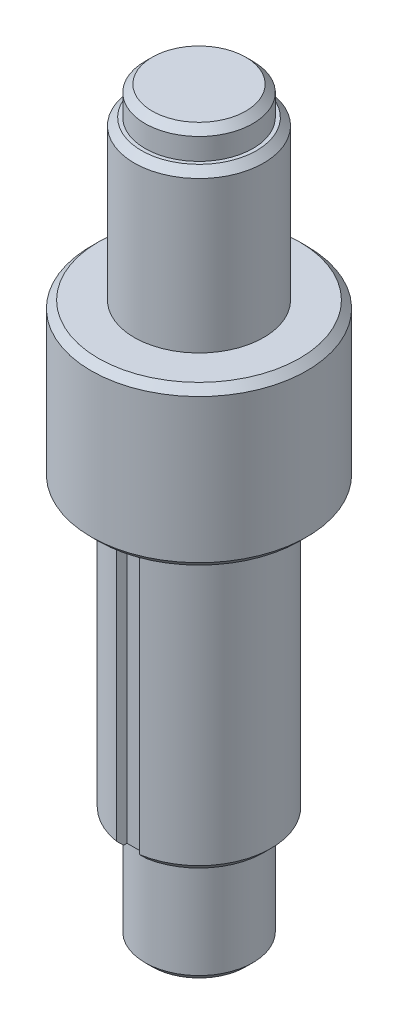
from build123d import *

# Parameters (mm, degrees)
SKETCH2_W          = 3.25
SKETCH2_H          = 3.25
CUT_EXTRUDE1_DEPTH = 40
CHAMFER1_SIZE      = 1
SKETCH3_W          = 3.25
SKETCH3_H          = 3.25
CUT_EXTRUDE2_DEPTH = 22


with BuildPart() as part:
    # Sketch1 → Revolve1 (revolve)
    with BuildSketch(Plane.XY, mode=Mode.PRIVATE) as revolve1_sk:
        Polygon((0, 0), (7.5, 0), (7.5, 15), (10, 15), (10, 55), (15, 55), (15, 77), (9, 77), (9, 99), (7.5, 99), (7.5, 103), (0, 103), align=None)
    revolve(revolve1_sk.sketch.rotate(Axis((0, 103, 0), (0, -1, 0)), 90), axis=Axis((0, 103, 0), (0, -1, 0)))

    # Sketch2 → Cut-Extrude1 (cut)
    with BuildSketch(Plane.XZ.offset(-15)):
        with Locations((0, 10)):
            Rectangle(SKETCH2_W, SKETCH2_H)
    extrude(amount=-CUT_EXTRUDE1_DEPTH, mode=Mode.SUBTRACT)

    # Chamfer1
    chamfer1_edges = [part.edges().sort_by_distance(p)[0] for p in [
        (0, 77, -15),
        (0, 55, -15),
        (0, 15, -10),
        (0, 0, -7.5),
        (0, 103, -7.5),
        (0, 99, -9),
    ]]
    chamfer(chamfer1_edges, length=CHAMFER1_SIZE)

    # Sketch3 → Cut-Extrude2 (cut)
    with BuildSketch(Plane(origin=(0, 99, 0), x_dir=(1, 0, 0), z_dir=(0, 1, 0))):
        with Locations((0, 9)):
            Rectangle(SKETCH3_W, SKETCH3_H)
    extrude(amount=-CUT_EXTRUDE2_DEPTH, mode=Mode.SUBTRACT)


solid = part.part
